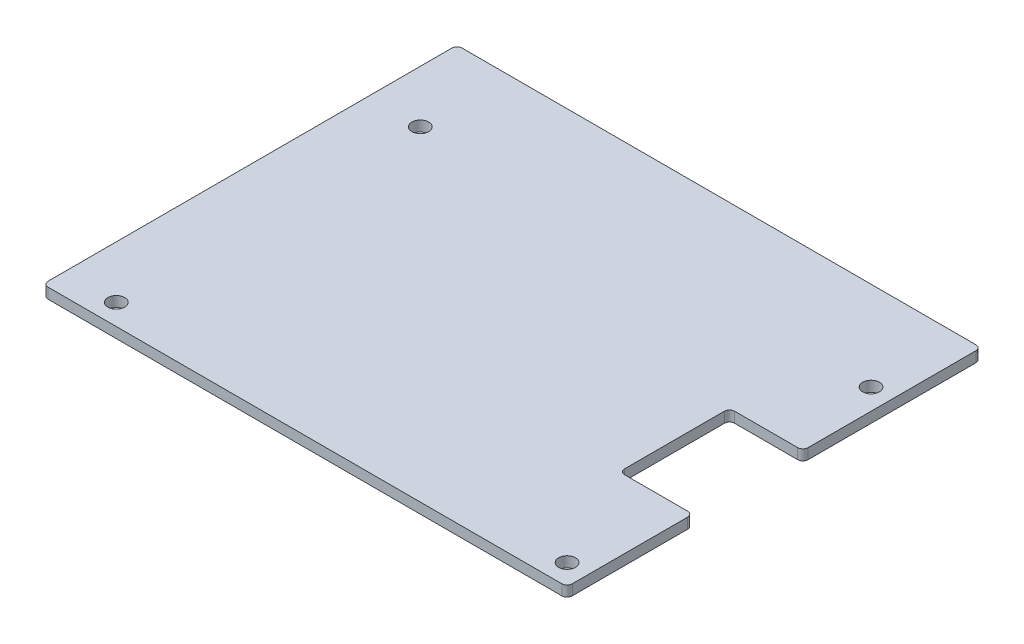
from build123d import *

# Parameters (mm, degrees)
SKETCH1_W            = 100
SKETCH1_H            = 79
BOSS_EXTRUDE1_DEPTH  = 2
CUT_EXTRUDE1_REACH   = 65.751
SKETCH2_W            = 14
SKETCH2_H            = 21
FILLET1_R            = 1
M3_CLEARANCE_HOLE1_D = 3.2


with BuildPart() as part:
    # Sketch1 → Boss-Extrude1 (new body)
    with BuildSketch(Plane(origin=(0, 0, 0), x_dir=(1, 0, 0), z_dir=(0, 1, 0))):
        Rectangle(SKETCH1_W, SKETCH1_H)
    extrude(amount=BOSS_EXTRUDE1_DEPTH)

    # Sketch2 → Cut-Extrude1 (cut, up to next)
    with BuildSketch(Plane(origin=(0, 2, 0), x_dir=(1, 0, 0), z_dir=(0, 1, 0)), mode=Mode.PRIVATE) as cut_extrude1_sk1:
        with Locations((43, -5)):
            Rectangle(SKETCH2_W, SKETCH2_H)
    cut_extrude1_tool1 = extrude(cut_extrude1_sk1.sketch, amount=-CUT_EXTRUDE1_REACH, mode=Mode.PRIVATE) & part.part
    add(cut_extrude1_tool1.solids().sort_by_distance((43, 2, 5))[0], mode=Mode.SUBTRACT)

    # Fillet1
    fillet1_edges = [part.edges().sort_by_distance(p)[0] for p in [
        (50, 1, -5.5),
        (50, 1, 15.5),
        (36, 1, 15.5),
        (36, 1, -5.5),
        (50, 1, 39.5),
        (-50, 1, 39.5),
        (-50, 1, -39.5),
        (50, 1, -39.5),
    ]]
    fillet(fillet1_edges, radius=FILLET1_R)

    # M3 Clearance Hole1 (through all)
    with Locations(Plane(origin=(0, 2, 0), x_dir=(1, 0, 0), z_dir=(0, 1, 0))):
        with Locations((-40, 22.5), (46, -35.5), (-40, -35.5), (46, 22.5)):
            Hole(M3_CLEARANCE_HOLE1_D / 2)


solid = part.part
